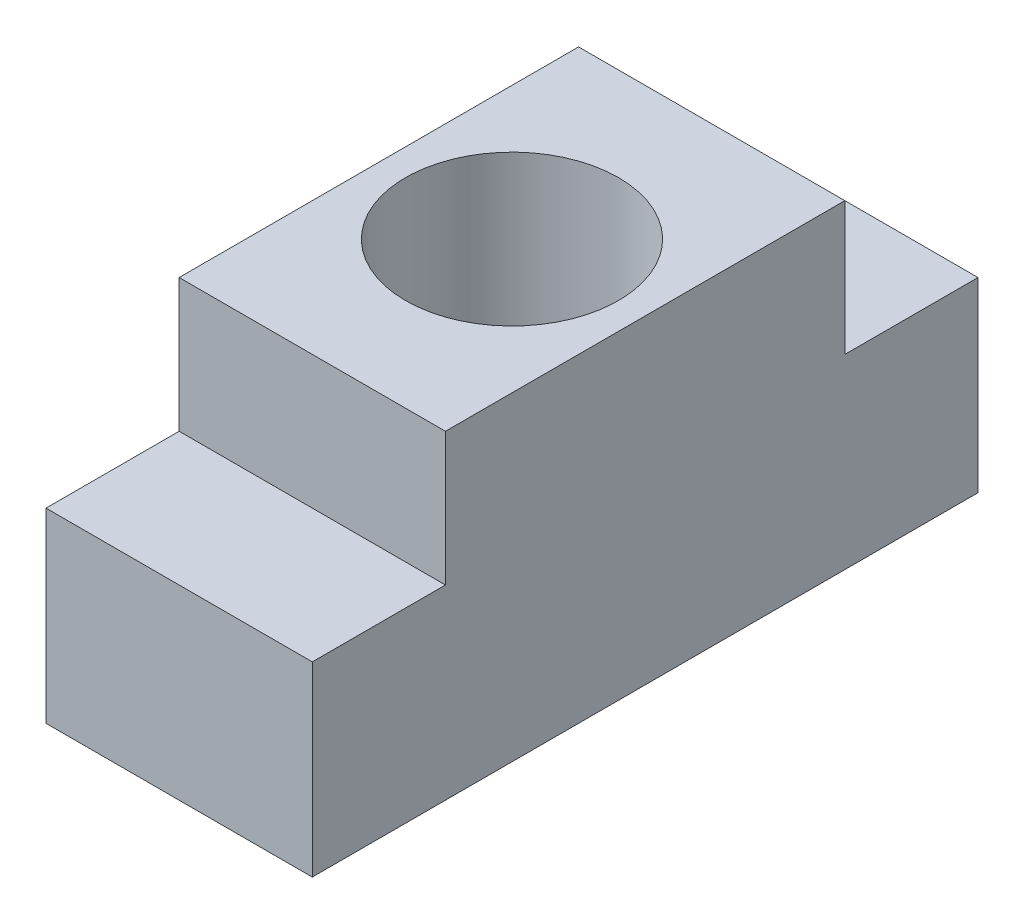
from build123d import *

# Parameters (mm, degrees)
RESSALTO_EXTRUS_O1_DEPTH = 10
ESBO_O6_R                = 4
CORTE_EXTRUS_O2_DEPTH    = 30.478805946


with BuildPart() as part:
    # Esboço2 → Ressalto-extrusão1 (new body)
    with BuildSketch(Plane(origin=(0, 0, 0), x_dir=(0, 0, -1), z_dir=(1, 0, 0))):
        Polygon((0, 0), (25, 0), (25, 7), (20, 7), (20, 12), (5, 12), (5, 7), (0, 7), align=None)
    extrude(amount=RESSALTO_EXTRUS_O1_DEPTH)

    # Esboço6 → Corte-extrusão2 (cut, through all)
    with BuildSketch(Plane(origin=(0, 12, 0), x_dir=(1, 0, 0), z_dir=(0, 1, 0))):
        with Locations(Location((5, 12.5, 0), (0, 0, 270))):
            Circle(ESBO_O6_R)
    extrude(amount=-CORTE_EXTRUS_O2_DEPTH, mode=Mode.SUBTRACT)


solid = part.part
